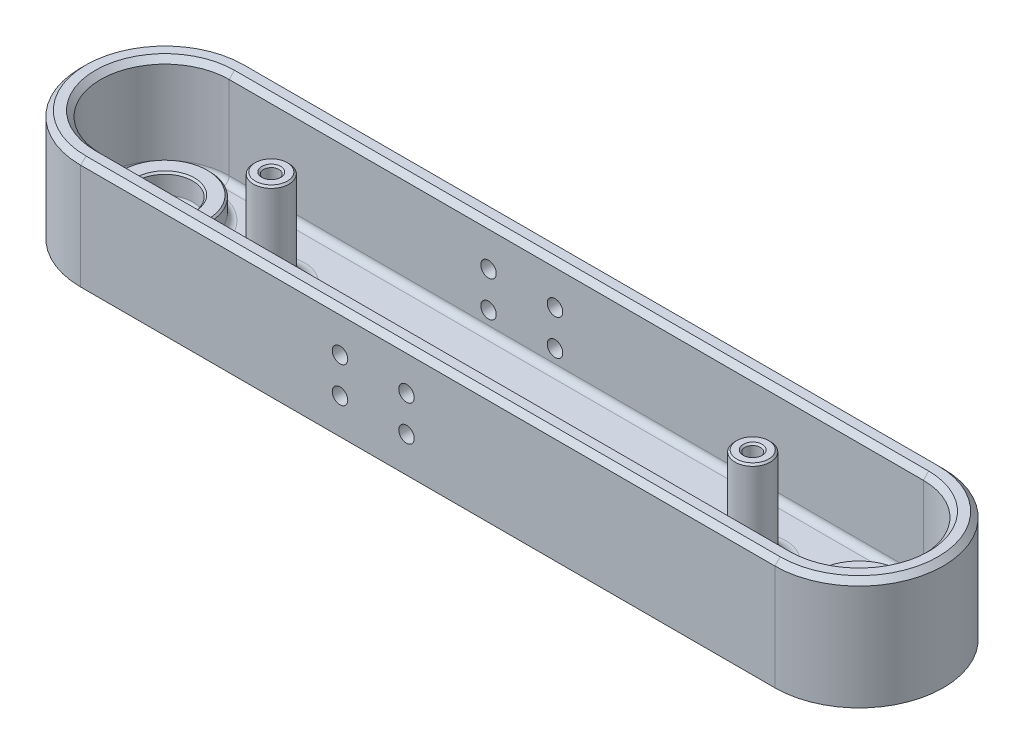
from build123d import *

# Parameters (mm, degrees)
MAINBLOCK_DEPTH                 = 31.75
MAINPOCKET_DEPTH                = 27.305
SKETCH3_R                       = 4.445
CUT_EXTRUDE1_DEPTH              = 130.846491832
SKETCH4_R                       = 12.7
SKETCH4_R_2                     = 7.95655
BOSS_EXTRUDE1_DEPTH             = 6.35
SKETCH7_R                       = 5.08
SKETCH7_R_2                     = 2.2225
BOSS_EXTRUDE3_DEPTH             = 27.305
FILLET2_R                       = 0.635
FILLET3_R                       = 1.905
FILLET6_R                       = 4.445
CHAMFER2_SIZE                   = 0.508
CHAMFER3_SIZE                   = 1.524
SKETCH10_R                      = 2.2225
BOSS_EXTRUDE4_DEPTH             = 16.51
SKETCH13_R                      = 2.2225
STABILIZER_BAR_MOUNTHOLES_DEPTH = 42.545


with BuildPart() as part:
    # Sketch1 → MainBlock (new body)
    with BuildSketch(Plane(origin=(0, 0, 0), x_dir=(1, 0, 0), z_dir=(0, 1, 0))):
        with BuildLine():
            Line((-99.441, 24.13), (99.441, 24.13))
            ThreePointArc((99.441, 24.13), (123.571, 0), (99.441, -24.13))
            Line((99.441, -24.13), (-99.441, -24.13))
            ThreePointArc((-99.441, -24.13), (-123.571, 0), (-99.441, 24.13))
        make_face()
    extrude(amount=MAINBLOCK_DEPTH)

    # Sketch2 → MainPocket (cut)
    with BuildSketch(Plane(origin=(0, 31.75, 0), x_dir=(1, 0, 0), z_dir=(0, 1, 0))):
        with BuildLine():
            Line((-99.441, 18.415), (99.441, 18.415))
            ThreePointArc((99.441, 18.415), (117.856, 0), (99.441, -18.415))
            Line((99.441, -18.415), (-99.441, -18.415))
            ThreePointArc((-99.441, -18.415), (-117.856, 0), (-99.441, 18.415))
        make_face()
    extrude(amount=-MAINPOCKET_DEPTH, mode=Mode.SUBTRACT)

    # Sketch3 → Cut-Extrude1 (cut, through all)
    with BuildSketch(Plane.XZ):
        with Locations(Location((-99.441, 0, 0), (0, 0, 270))):
            Circle(SKETCH3_R)
        with Locations(Location((99.441, 0, 0), (0, 0, 270))):
            Circle(SKETCH3_R)
    extrude(amount=-CUT_EXTRUDE1_DEPTH, mode=Mode.SUBTRACT)

    # Sketch4 → Boss-Extrude1 (add)
    # profile 1 of 2: a face of its own
    with BuildSketch(Plane(origin=(0, 4.445, 0), x_dir=(1, 0, 0), z_dir=(0, 1, 0))):
        with Locations(Location((-99.441, 0, 0), (0, 0, 270))):
            Circle(SKETCH4_R)
        with Locations(Location((-99.441, 0, 0), (0, 0, 270))):
            Circle(SKETCH4_R_2, mode=Mode.SUBTRACT)
    # profile 2 of 2: a face of its own
    with BuildSketch(Plane(origin=(0, 4.445, 0), x_dir=(1, 0, 0), z_dir=(0, 1, 0))):
        with Locations(Location((99.441, 0, 0), (0, 0, 90))):
            Circle(SKETCH4_R)
        with Locations(Location((99.441, 0, 0), (0, 0, 90))):
            Circle(SKETCH4_R_2, mode=Mode.SUBTRACT)
    extrude(amount=BOSS_EXTRUDE1_DEPTH)

    # Sketch7 → Boss-Extrude3 (add)
    # profile 1 of 2: a face of its own
    with BuildSketch(Plane(origin=(0, 4.445, 0), x_dir=(1, 0, 0), z_dir=(0, 1, 0))):
        with Locations(Location((-68.961, 0, 0), (0, 0, 270))):
            Circle(SKETCH7_R)
        with Locations(Location((-68.961, 0, 0), (0, 0, 270))):
            Circle(SKETCH7_R_2, mode=Mode.SUBTRACT)
    # profile 2 of 2: a face of its own
    with BuildSketch(Plane(origin=(0, 4.445, 0), x_dir=(1, 0, 0), z_dir=(0, 1, 0))):
        with Locations(Location((68.961, 0, 0), (0, 0, 270))):
            Circle(SKETCH7_R)
        with Locations(Location((68.961, 0, 0), (0, 0, 270))):
            Circle(SKETCH7_R_2, mode=Mode.SUBTRACT)
    extrude(amount=BOSS_EXTRUDE3_DEPTH)

    # Fillet2
    fillet2_edges = [part.edges().sort_by_distance(p)[0] for p in [
        (-99.441, 4.445, -7.95655),
        (99.441, 4.445, 7.95655),
    ]]
    fillet(fillet2_edges, radius=FILLET2_R)

    # Fillet3
    fillet3_edges = [part.edges().sort_by_distance(p)[0] for p in [
        (117.856, 4.445, 0),
        (0, 4.445, 18.415),
        (-117.856, 4.445, 0),
        (0, 4.445, -18.415),
        (-99.441, 4.445, -12.7),
        (99.441, 4.445, 12.7),
    ]]
    fillet(fillet3_edges, radius=FILLET3_R)

    # Fillet6
    fillet6_edges = [part.edges().sort_by_distance(p)[0] for p in [
        (-68.961, 4.445, -5.08),
        (68.961, 4.445, -5.08),
    ]]
    fillet(fillet6_edges, radius=FILLET6_R)

    # Chamfer2
    chamfer2_edges = [part.edges().sort_by_distance(p)[0] for p in [
        (-99.441, 4.445, 4.445),
        (99.441, 4.445, 4.445),
        (-99.441, 10.795, -12.7),
        (-99.441, 10.795, -7.95655),
        (99.441, 10.795, 12.7),
        (99.441, 10.795, 7.95655),
        (-68.961, 31.75, -2.2225),
        (-68.961, 31.75, -5.08),
        (68.961, 31.75, -2.2225),
        (68.961, 31.75, -5.08),
    ]]
    chamfer(chamfer2_edges, length=CHAMFER2_SIZE)

    # Chamfer3
    chamfer3_edges = [part.edges().sort_by_distance(p)[0] for p in [
        (123.571, 31.75, 0),
        (0, 31.75, -24.13),
        (117.856, 31.75, 0),
        (0, 31.75, -18.415),
        (-117.856, 31.75, 0),
        (0, 31.75, 18.415),
        (-123.571, 31.75, 0),
        (0, 31.75, 24.13),
    ]]
    chamfer(chamfer3_edges, length=CHAMFER3_SIZE)

    # Sketch10 → Boss-Extrude4 (add)
    with BuildSketch(Plane(origin=(0, 4.445, 0), x_dir=(1, 0, 0), z_dir=(0, 1, 0))):
        with Locations(Location((68.961, 0, 0), (0, 0, 270))):
            Circle(SKETCH10_R)
        with Locations(Location((-68.961, 0, 0), (0, 0, 270))):
            Circle(SKETCH10_R)
    extrude(amount=BOSS_EXTRUDE4_DEPTH)

    # Sketch13 → Stabilizer-Bar-MountHoles (cut)
    with BuildSketch(Plane(origin=(0, 0, -24.13), x_dir=(-1, 0, 0), z_dir=(0, 0, -1))):
        with Locations((25.146, 20.32)):
            Circle(SKETCH13_R)
        with Locations((6.096, 20.32)):
            Circle(SKETCH13_R)
        with Locations((6.096, 10.16)):
            Circle(SKETCH13_R)
        with Locations((25.146, 10.16)):
            Circle(SKETCH13_R)
    stabilizer_bar_mountholes = extrude(amount=-STABILIZER_BAR_MOUNTHOLES_DEPTH, mode=Mode.SUBTRACT)

    # Mirror1: Stabilizer-Bar-MountHoles across plane
    add(stabilizer_bar_mountholes.mirror(Plane.XY), mode=Mode.SUBTRACT)


solid = part.part
